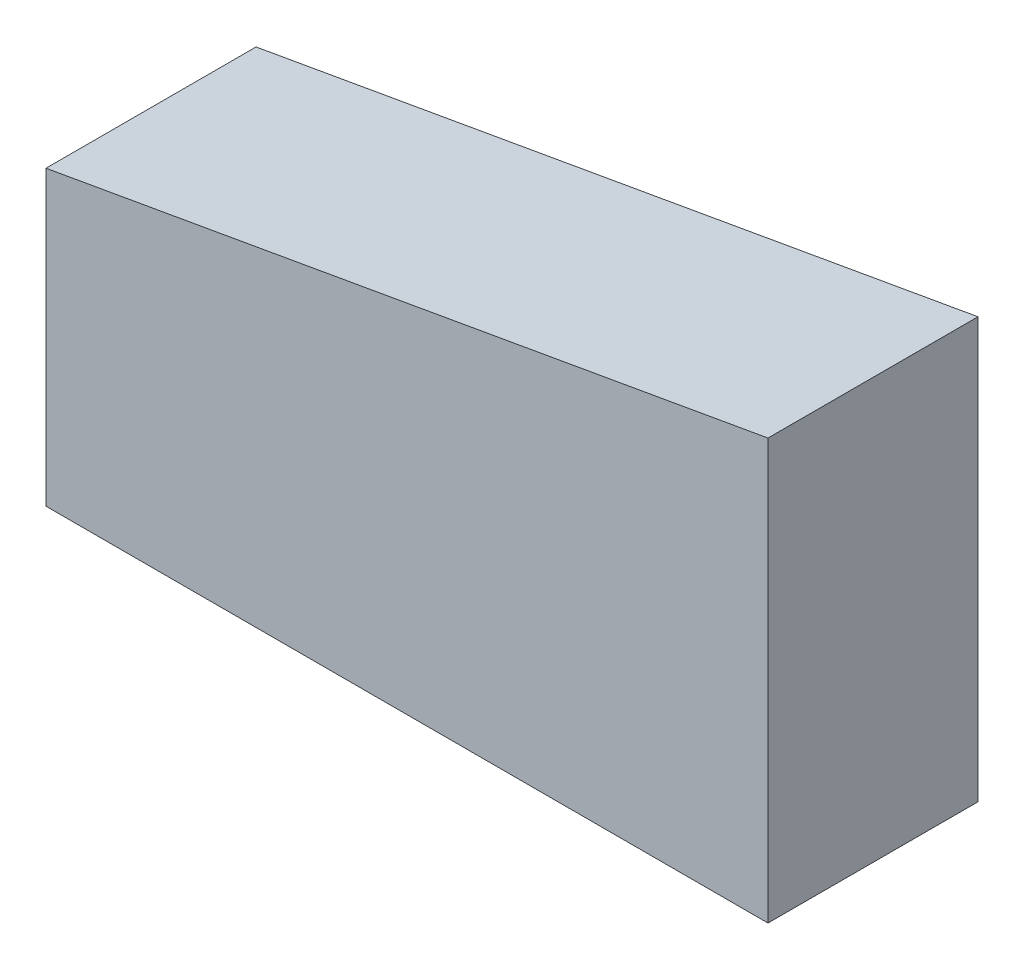
from build123d import *

# Parameters (mm, degrees)
BOSS_EXTRU_1_DEPTH = 16


with BuildPart() as part:
    # Esquisse1 → Boss.-Extru.1 (new body)
    with BuildSketch(Plane.XY):
        Polygon((0, 0), (-55, 0), (-55, 22.302016061), (0, 32), align=None)
    extrude(amount=BOSS_EXTRU_1_DEPTH)


solid = part.part
